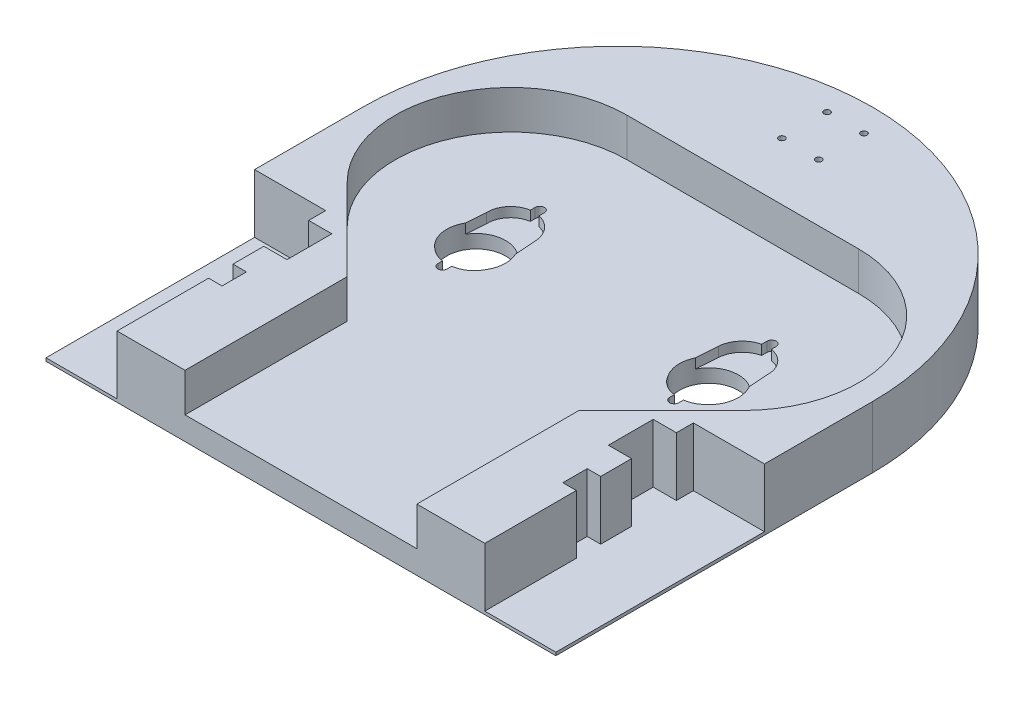
from build123d import *

# Parameters (mm, degrees)
ESQUISSE1_W              = 330
ESQUISSE1_H              = 370
CORP_DEPTH               = 40
CONG_AVANT_RADIUS        = 165
CONG_AVANT_LENGTH        = 40
TROU_POUR_ROUE_DEPTH     = 38
ESQUISSE4_R              = 2
TROU_POUR_ROULETTE_DEPTH = 50
TROU_POUR_BALAYEUR_DEPTH = 25
MOTEUR_PALE_DEPTH        = 6.3
ESQUISSE7_R              = 3
ENL_V_MAT_EXTRU_10_DEPTH = 6.3
ESQUISSE8_W              = 6
ESQUISSE8_H              = 3.075554286
ENL_V_MAT_EXTRU_11_DEPTH = 6.3
ESQUISSE9_R              = 19.061984771
ENL_V_MAT_EXTRU_12_DEPTH = 33


with BuildPart() as part:
    # Esquisse1 → corp (new body)
    with BuildSketch(Plane(origin=(0, 0, 0), x_dir=(1, 0, 0), z_dir=(0, 1, 0))):
        with Locations((165, 185)):
            Rectangle(ESQUISSE1_W, ESQUISSE1_H)
    extrude(amount=CORP_DEPTH)

    # congé avant: full round fillet: the end face becomes a half cylinder, R = half its width
    cong_avant_face = Plane((165, 20, -370), x_dir=(0, 1, 0), z_dir=(0, 0, -1))  # on the end face: x along it, z out of the body
    cong_avant_slab = cong_avant_face.offset(-CONG_AVANT_RADIUS / 2) * Box(CONG_AVANT_LENGTH, 2 * CONG_AVANT_RADIUS, CONG_AVANT_RADIUS, mode=Mode.PRIVATE)  # the body's end, R deep
    cong_avant_round = Plane((165, 20, -205), x_dir=(0, 0, -1), z_dir=(0, 1, 0)) * Cylinder(CONG_AVANT_RADIUS, CONG_AVANT_LENGTH, mode=Mode.PRIVATE)  # its axis R under the face
    add(cong_avant_slab - cong_avant_round, mode=Mode.SUBTRACT)

    # Esquisse3 → trou pour roue (cut)
    with BuildSketch(Plane(origin=(0, 40, 0), x_dir=(1, 0, 0), z_dir=(0, 1, 0))):
        Polygon((46, 124), (46, 135), (0, 135), (0, 0), (46, 0), (46, 59.234399469), (54.724206143, 59.234399469), (54.724206143, 75), (46, 75), (46, 95), (61, 95), (61, 124), align=None)
        Polygon((284, 95), (284, 75), (275.275793857, 75), (275.275793857, 59.234399469), (284, 59.234399469), (284, 0), (330, 0), (330, 135), (284, 135), (284, 124), (269, 124), (269, 95), align=None)
    extrude(amount=-TROU_POUR_ROUE_DEPTH, mode=Mode.SUBTRACT)

    # Esquisse4 → trou pour roulette (cut)
    with BuildSketch(Plane(origin=(0, 40, 0), x_dir=(1, 0, 0), z_dir=(0, 1, 0))):
        with Locations(Location((176.95, 352.458632269, 0), (0, 0, 270))):
            Circle(ESQUISSE4_R)
        with Locations(Location((176.95, 323.158632269, 0), (0, 0, 90))):
            Circle(ESQUISSE4_R)
        with Locations(Location((153.05, 323.158632269, 0), (0, 0, 270))):
            Circle(ESQUISSE4_R)
        with Locations(Location((153.05, 352.458632269, 0), (0, 0, 90))):
            Circle(ESQUISSE4_R)
    extrude(amount=-TROU_POUR_ROULETTE_DEPTH, mode=Mode.SUBTRACT)

    # Esquisse5 → Trou pour balayeur (cut)
    with BuildSketch(Plane(origin=(0, 40, 0), x_dir=(1, 0, 0), z_dir=(0, 1, 0))):
        with BuildLine():
            Line((90, 286), (240, 286))
            ThreePointArc((240, 286), (309.290964938, 239.701257427), (293.033008589, 157.966991411))
            Line((293.033008589, 157.966991411), (240, 104.933982822))
            Line((240, 104.933982822), (240, 0))
            Line((240, 0), (90, 0))
            Line((90, 0), (90, 104.933982822))
            Line((90, 104.933982822), (36.966991411, 157.966991411))
            ThreePointArc((36.966991411, 157.966991411), (20.709035062, 239.701257427), (90, 286))
        make_face()
    extrude(amount=-TROU_POUR_BALAYEUR_DEPTH, mode=Mode.SUBTRACT)

    # Esquisse6 → moteur pale (cut)
    with BuildSketch(Plane(origin=(0, 15, 0), x_dir=(1, 0, 0), z_dir=(0, 1, 0))):
        with BuildLine():
            Line((257.506073255, 187.1), (255.885842754, 211))
            ThreePointArc((255.885842754, 211), (251.445088501, 222.191160152), (240.245274455, 226.610043405))
            ThreePointArc((240.245274455, 226.610043405), (240.122739998, 226.602511903), (240, 226.6))
            ThreePointArc((240, 226.6), (229.088615697, 221.822854824), (224.114157246, 211))
            Line((224.114157246, 211), (222.506073255, 187.1))
            ThreePointArc((222.506073255, 187.1), (227.152012558, 174.508282489), (239.63580106, 169.57967959))
            ThreePointArc((239.63580106, 169.57967959), (239.977179555, 169.600029468), (240.318655983, 169.581395004))
            ThreePointArc((240.318655983, 169.581395004), (252.842661862, 174.484702191), (257.506073255, 187.1))
        make_face()
        with BuildLine():
            ThreePointArc((89.754725545, 226.610043405), (78.554911499, 222.191160152), (74.114157246, 211))
            Line((74.114157246, 211), (72.493926745, 187.1))
            ThreePointArc((72.493926745, 187.1), (77.157338138, 174.484702191), (89.681344017, 169.581395004))
            ThreePointArc((89.681344017, 169.581395004), (90.022820445, 169.600029468), (90.36419894, 169.57967959))
            ThreePointArc((90.36419894, 169.57967959), (102.847987442, 174.508282489), (107.493926745, 187.1))
            Line((107.493926745, 187.1), (105.885842754, 211))
            ThreePointArc((105.885842754, 211), (100.911384303, 221.822854824), (90, 226.6))
            ThreePointArc((90, 226.6), (89.877260002, 226.602511903), (89.754725545, 226.610043405))
        make_face()
    extrude(amount=-MOTEUR_PALE_DEPTH, mode=Mode.SUBTRACT)

    # Esquisse7 → Enlèv. mat.-Extru.10 (cut)
    with BuildSketch(Plane(origin=(0, 15, 0), x_dir=(1, 0, 0), z_dir=(0, 1, 0))):
        with Locations((240, 229.6)):
            Circle(ESQUISSE7_R)
        with Locations((90, 229.6)):
            Circle(ESQUISSE7_R)
        with Locations((90.015284108, 166.600038934)):
            Circle(ESQUISSE7_R)
        with Locations((239.984715892, 166.600038934)):
            Circle(ESQUISSE7_R)
    extrude(amount=-ENL_V_MAT_EXTRU_10_DEPTH, mode=Mode.SUBTRACT)

    # Esquisse8 → Enlèv. mat.-Extru.11 (cut)
    with BuildSketch(Plane(origin=(0, 15, 0), x_dir=(1, 0, 0), z_dir=(0, 1, 0))):
        Polygon((93, 229.6), (93, 226.178416603), (87, 226.178416603), (87, 226.449068216), (87, 229.6), align=None)
        Polygon((237, 226.178416603), (243, 226.178416603), (243, 226.449068216), (243, 229.6), (237, 229.6), align=None)
        with Locations((90.015284108, 168.137816077)):
            Rectangle(ESQUISSE8_W, ESQUISSE8_H)
        with Locations((239.984715892, 168.137816077)):
            Rectangle(ESQUISSE8_W, ESQUISSE8_H)
    extrude(amount=-ENL_V_MAT_EXTRU_11_DEPTH, mode=Mode.SUBTRACT)

    # Esquisse9 → Enlèv. mat.-Extru.12 (cut)
    with BuildSketch(Plane(origin=(0, 15, 0), x_dir=(1, 0, 0), z_dir=(0, 1, 0))):
        with Locations(Location((240.309161112, 188.734839537, 0), (0, 0, 307.62761802))):
            Circle(ESQUISSE9_R)
        with Locations(Location((89.690838888, 188.734839537, 0), (0, 0, 232.37238198))):
            Circle(ESQUISSE9_R)
    extrude(amount=-ENL_V_MAT_EXTRU_12_DEPTH, mode=Mode.SUBTRACT)


solid = part.part
